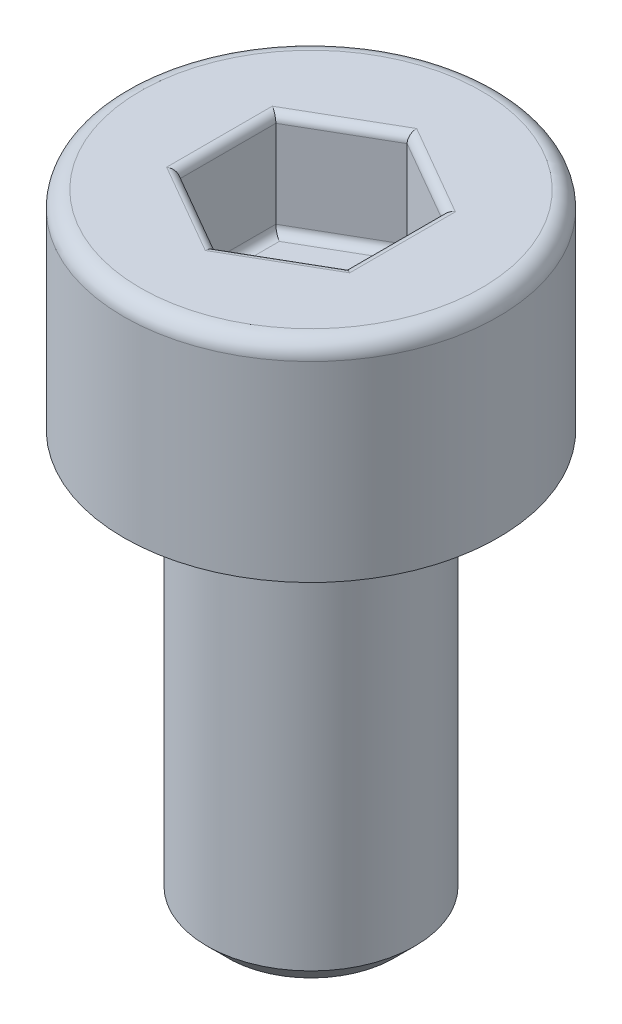
from build123d import *

# Parameters (mm, degrees)
CHAMFER1_SIZE      = 0.25
FILLET1_R          = 0.2
CUT_EXTRUDE1_DEPTH = 1.25
FILLET2_R          = 0.1


with BuildPart() as part:
    # Sketch1 → Revolve1 (revolve)
    with BuildSketch(Plane.XY, mode=Mode.PRIVATE) as revolve1_sk:
        Polygon((0, -7.5), (-1.25, -7.5), (-1.25, -2.5), (-2.25, -2.5), (-2.25, 0), (0, 0), align=None)
    revolve(revolve1_sk.sketch.rotate(Axis((0, 0, 0), (0, -1, 0)), 270), axis=Axis((0, 0, 0), (0, -1, 0)))

    # Chamfer1
    chamfer1_edges = [part.edges().sort_by_distance(p)[0] for p in [
        (0, -2.5, -1.25),
        (0, -7.5, -1.25),
    ]]
    chamfer(chamfer1_edges, length=CHAMFER1_SIZE)

    # Fillet1
    fillet1_edges = [part.edges().sort_by_distance(p)[0] for p in [
        (0, 0, -2.25),
    ]]
    fillet(fillet1_edges, radius=FILLET1_R)

    # Sketch2 → Cut-Extrude1 (cut)
    with BuildSketch(Plane(origin=(0, 0, 0), x_dir=(1, 0, 0), z_dir=(0, 1, 0))):
        Polygon((0, 1.154700538), (-1, 0.577350269), (-1, -0.577350269), (0, -1.154700538), (1, -0.577350269), (1, 0.577350269), align=None)
    extrude(amount=-CUT_EXTRUDE1_DEPTH, mode=Mode.SUBTRACT)

    # Fillet2
    fillet2_edges = [part.edges().sort_by_distance(p)[0] for p in [
        (0.5, -1.25, -0.866025404),
        (1, -1.25, 0),
        (0.5, -1.25, 0.866025404),
        (-0.5, -1.25, 0.866025404),
        (-1, -1.25, 0),
        (-0.5, -1.25, -0.866025404),
        (0.4999999999999987, 0, -0.8660254037844397),
        (-0.5000000000000006, 0, -0.8660254037844395),
        (-1, 0, 0),
        (-0.5000000000000007, 0, 0.8660254037844379),
        (0.4999999999999988, 0, 0.8660254037844382),
        (1, 0, 0),
    ]]
    fillet(fillet2_edges, radius=FILLET2_R)


solid = part.part
